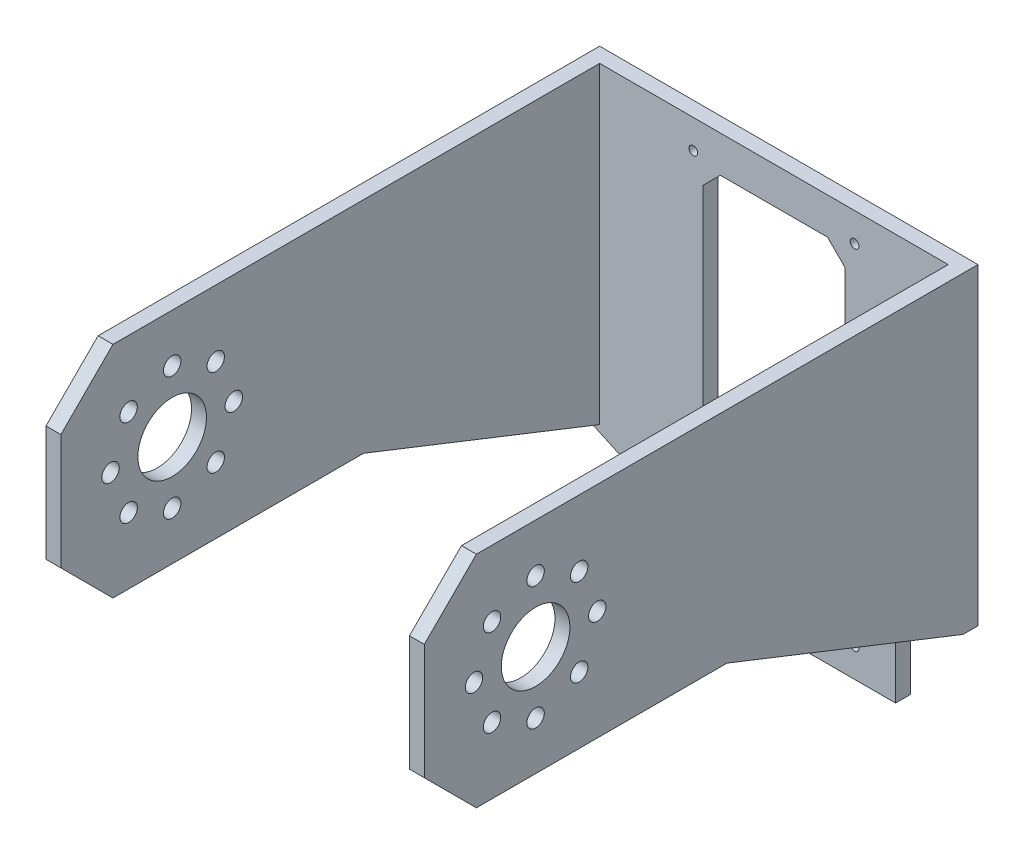
from build123d import *

# Parameters (mm, degrees)
BOSS_EXTRUDE1_DEPTH = 12.605
CUT_EXTRUDE1_DEPTH  = 32.2
SKETCH3_R           = 3.935
SKETCH3_R_2         = 1
CUT_EXTRUDE2_DEPTH  = 32.2
BOSS_EXTRUDE2_DEPTH = 21.39
SKETCH6_R           = 0.5
SKETCH6_W           = 16.3
SKETCH6_H           = 38.2
CUT_EXTRUDE4_DEPTH  = 45
CUT_EXTRUDE5_DEPTH  = 68
CHAMFER3_SIZE       = 2


with BuildPart() as part:
    # Sketch1 → Boss-Extrude1 (new, symmetric)
    with BuildSketch(Plane(origin=(0, 0, -0.087739129), x_dir=(1, 0, 0), z_dir=(0, 1, 0))):
        Polygon((0, 0), (-21.71, 0), (-21.71, -63.54), (-20, -63.54), (-20, -1.71), (0, -1.71), align=None)
    boss_extrude1 = extrude(amount=BOSS_EXTRUDE1_DEPTH, both=True)

    # Sketch2 → Cut-Extrude1 (cut)
    with BuildSketch(Plane(origin=(-21.71, 0, -0.087739129), x_dir=(0, 0, 1), z_dir=(-1, 0, 0))):
        Polygon((57.565, 12.605), (63.54, 6.63), (63.54, 12.605), align=None)
        Polygon((63.54, -6.63), (57.565, -12.605), (63.54, -12.605), align=None)
    cut_extrude1 = extrude(amount=-CUT_EXTRUDE1_DEPTH, mode=Mode.SUBTRACT)

    # Sketch3 → Cut-Extrude2 (cut)
    with BuildSketch(Plane(origin=(-21.71, 0, -0.087739129), x_dir=(0, 0, 1), z_dir=(-1, 0, 0))):
        with Locations((50.77, 0)):
            Circle(SKETCH3_R)
        with Locations((45.77, 5)):
            Circle(SKETCH3_R_2)
        with Locations((55.77, 5)):
            Circle(SKETCH3_R_2)
        with Locations((55.77, -5)):
            Circle(SKETCH3_R_2)
        with Locations((45.77, -5)):
            Circle(SKETCH3_R_2)
        with Locations((43.698932188, 0)):
            Circle(SKETCH3_R_2)
        with Locations((50.77, -7.071067812)):
            Circle(SKETCH3_R_2)
        with Locations((57.841067812, 0)):
            Circle(SKETCH3_R_2)
        with Locations((50.77, 7.071067812)):
            Circle(SKETCH3_R_2)
    cut_extrude2 = extrude(amount=-CUT_EXTRUDE2_DEPTH, mode=Mode.SUBTRACT)

    # Mirror1: Boss-Extrude1, Cut-Extrude1, Cut-Extrude2 across plane
    add(boss_extrude1.mirror(Plane(origin=(0, 12.605, 1.622260871), x_dir=(0, 0, 1), z_dir=(-1, 0, 0))))
    add(cut_extrude1.mirror(Plane(origin=(0, 12.605, 1.622260871), x_dir=(0, 0, 1), z_dir=(-1, 0, 0))), mode=Mode.SUBTRACT)
    add(cut_extrude2.mirror(Plane(origin=(0, 12.605, 1.622260871), x_dir=(0, 0, 1), z_dir=(-1, 0, 0))), mode=Mode.SUBTRACT)

    # Sketch5 → Boss-Extrude2 (add)
    with BuildSketch(Plane(origin=(0, -12.605, -0.087739129), x_dir=(1, 0, 0), z_dir=(0, -1, 0))):
        Polygon((-21.71, 28.8), (-20, 28.8), (-20, 1.71), (20, 1.71), (20, 28.8), (21.71, 28.8), (21.71, 0), (-21.71, 0), align=None)
    extrude(amount=BOSS_EXTRUDE2_DEPTH)

    # Sketch6 → Cut-Extrude4 (cut)
    with BuildSketch(Plane(origin=(0, 0, -0.087739129), x_dir=(-1, 0, 0), z_dir=(0, 0, -1))):
        with Locations((-9.25, 9.305)):
            Circle(SKETCH6_R)
        with Locations((9.25, 9.305)):
            Circle(SKETCH6_R)
        with Locations((9.25, -30.695)):
            Circle(SKETCH6_R)
        with Locations((-9.25, -30.695)):
            Circle(SKETCH6_R)
        Polygon((-21.71, -26.845), (-21.71, -33.995), (-13.96, -33.995), (-13.96, -26.845), (-21.71, -23.295), align=None)
        Polygon((21.71, -23.295), (13.96, -26.845), (13.96, -33.995), (21.71, -33.995), (21.71, -26.845), align=None)
        with Locations((0, -10.695)):
            Rectangle(SKETCH6_W, SKETCH6_H)
    extrude(amount=-CUT_EXTRUDE4_DEPTH, mode=Mode.SUBTRACT)

    # Sketch7 → Cut-Extrude5 (cut)
    with BuildSketch(Plane(origin=(21.71, 0, 0), x_dir=(0, 0, -1), z_dir=(1, 0, 0))):
        Polygon((-28.712260871, -12.605), (-1.622260871, -23.295), (-1.622260871, -35.593839202), (-28.712260871, -35.593839202), align=None)
    extrude(amount=-CUT_EXTRUDE5_DEPTH, mode=Mode.SUBTRACT)

    # Chamfer3
    chamfer3_edges = [part.edges().sort_by_distance(p)[0] for p in [
        (-8.15, 8.405, 0.767260871),
        (-8.15, -29.795, 0.767260871),
        (8.15, -29.795, 0.767260871),
        (8.15, 8.405, 0.767260871),
    ]]
    chamfer(chamfer3_edges, length=CHAMFER3_SIZE)


solid = part.part
